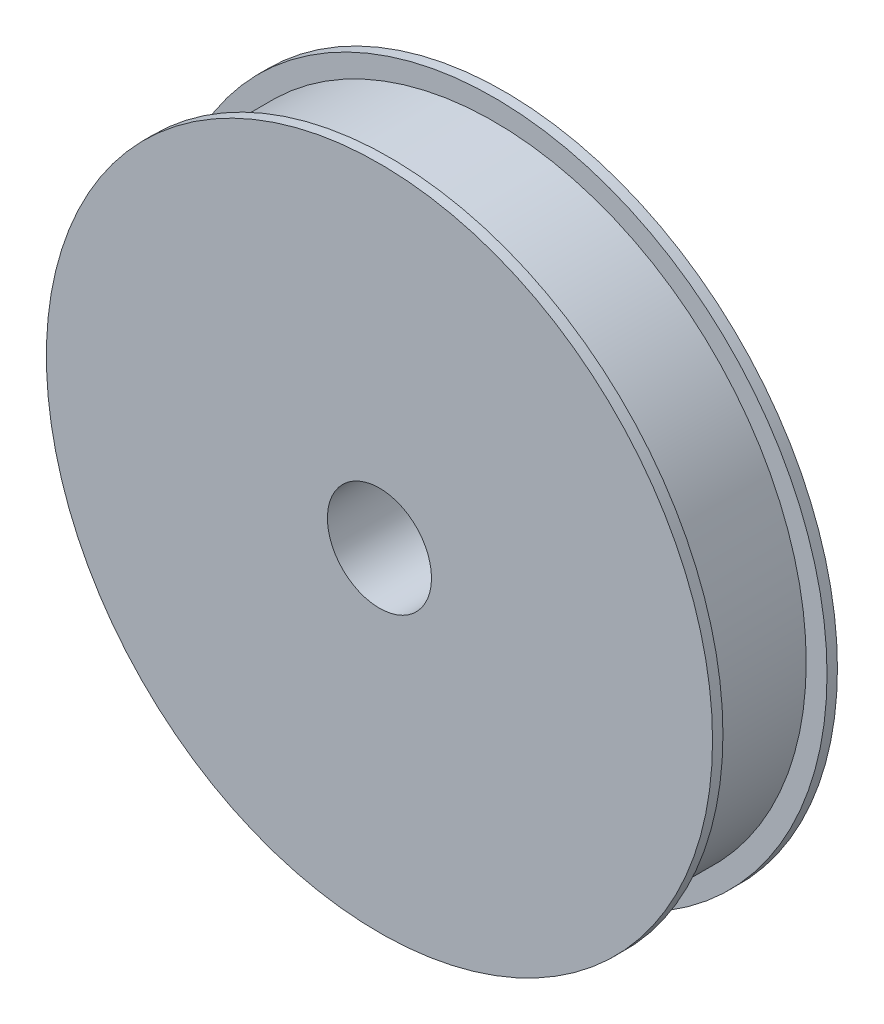
from build123d import *

# Parameters (mm, degrees)
CUT_EXTRUDE1_DEPTH      = 46.650848842
CUT_EXTRUDE1_DEPTH_BACK = 46.650848842
SKETCH3_R               = 5


with BuildPart() as part:
    # Sketch1 → Revolve1 (revolve)
    with BuildSketch(Plane(origin=(0, 0, 0), x_dir=(0, 0, -1), z_dir=(1, 0, 0)), mode=Mode.PRIVATE) as revolve1_sk:
        Polygon((-5, 32), (-5, 30), (5, 30), (5, 32), (6, 32), (6, 0), (-6, 0), (-6, 32), align=None)
    revolve(revolve1_sk.sketch.rotate(Axis((0, 0, 6), (0, 0, -1)), 90), axis=Axis((0, 0, 6), (0, 0, -1)))

    # Sketch3 → Cut-Extrude1 (cut, two sides: drawn at the far end of the back side and taken through both)
    with BuildSketch(Plane.XY.offset(-CUT_EXTRUDE1_DEPTH_BACK)):
        Circle(SKETCH3_R)
    extrude(amount=CUT_EXTRUDE1_DEPTH + CUT_EXTRUDE1_DEPTH_BACK, mode=Mode.SUBTRACT)


solid = part.part
